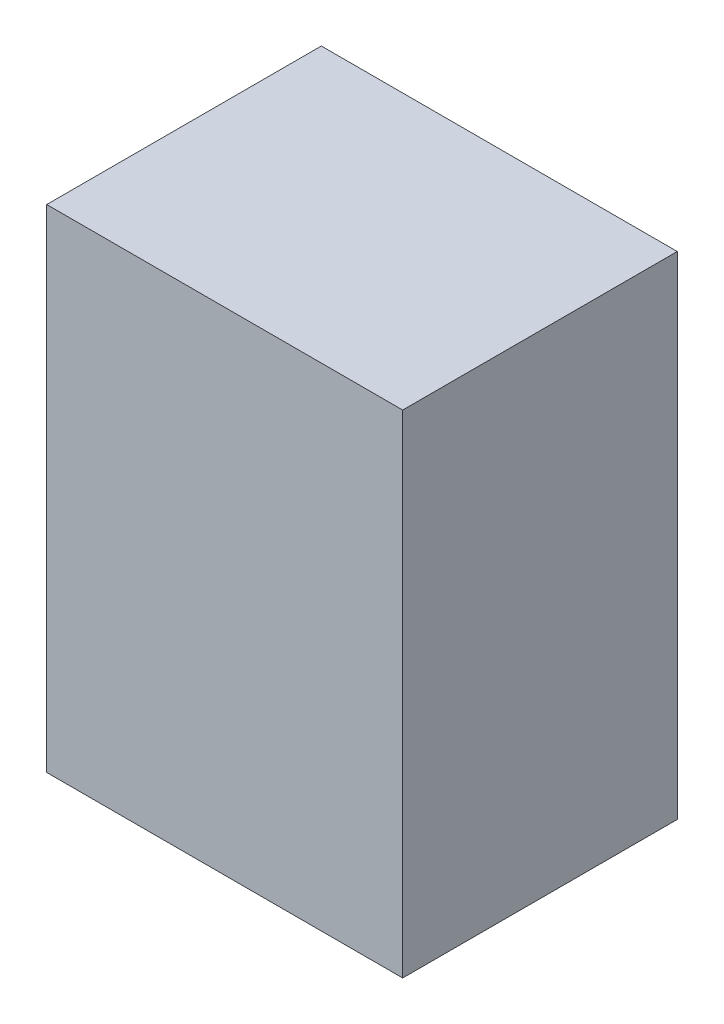
from build123d import *

# Parameters (mm, degrees)
SKETCH1_W           = 155.56
SKETCH1_H           = 120
BOSS_EXTRUDE1_DEPTH = 214.97
SCALE1_SCALE        = 0.75


with BuildPart() as part:
    # Sketch1 → Boss-Extrude1 (new body)
    with BuildSketch(Plane(origin=(0, 0, 0), x_dir=(1, 0, 0), z_dir=(0, 1, 0))):
        Rectangle(SKETCH1_W, SKETCH1_H)
    extrude(amount=BOSS_EXTRUDE1_DEPTH)


with BuildPart() as part_1:
    # Scale1: scaled about (0, 107.485, 0)
    add(part.part.scale(SCALE1_SCALE).moved(Location((0, 26.87125, 0))))


solid = part_1.part
